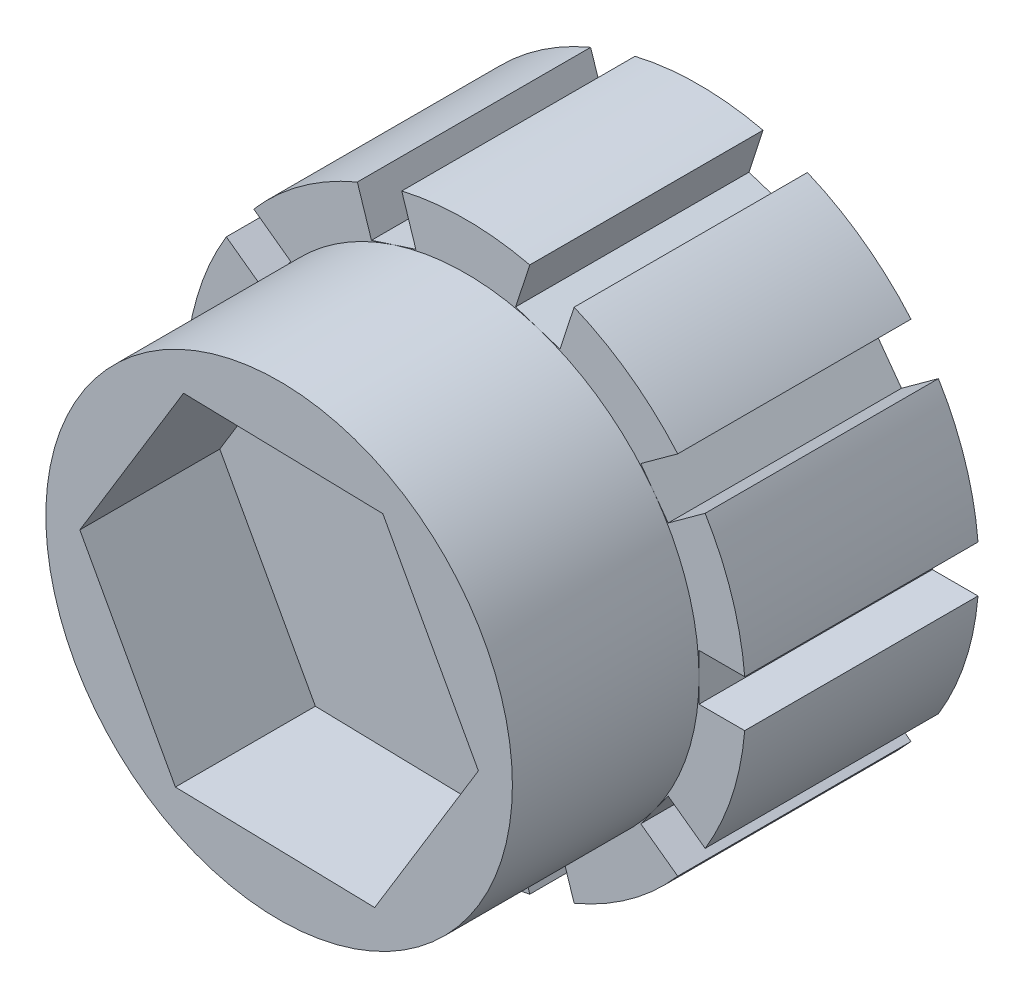
from build123d import *

# Parameters (mm, degrees)
SKETCH1_R           = 6
BOSS_EXTRUDE1_DEPTH = 5
SKETCH2_R           = 5
BOSS_EXTRUDE2_DEPTH = 4
CUT_EXTRUDE1_DEPTH  = 3
SKETCH4_W           = 2
SKETCH4_H           = 1
CUT_EXTRUDE2_DEPTH  = 10


with BuildPart() as part:
    # Sketch1 → Boss-Extrude1 (new body)
    with BuildSketch(Plane.XY):
        Circle(SKETCH1_R)
    extrude(amount=BOSS_EXTRUDE1_DEPTH)

    # Sketch2 → Boss-Extrude2 (add)
    with BuildSketch(Plane.XY.offset(5)):
        Circle(SKETCH2_R)
    extrude(amount=BOSS_EXTRUDE2_DEPTH)

    # Sketch3 → Cut-Extrude1 (cut)
    with BuildSketch(Plane.XY.offset(9)):
        Polygon((2.048231561, -3.749410728), (4.27120072, -0.1008848), (2.222969159, 3.648525928), (-2.048231561, 3.749410728), (-4.27120072, 0.1008848), (-2.222969159, -3.648525928), align=None)
    extrude(amount=-CUT_EXTRUDE1_DEPTH, mode=Mode.SUBTRACT)

    # Sketch4 → Cut-Extrude2 (cut)
    with BuildSketch(Plane(origin=(0, 0, 0), x_dir=(-1, 0, 0), z_dir=(0, 0, -1))):
        Polygon((5.957011587, -3.709988269), (5.369226334, -4.519005263), (3.751192346, -3.343434759), (4.338977598, -2.534417764), align=None)
        with Locations((6, 0)):
            Rectangle(SKETCH4_W, SKETCH4_H)
        Polygon((2.638647219, -6.502887117), (1.687590702, -6.811904111), (1.069556714, -4.909791079), (2.02061323, -4.600774084), align=None)
        Polygon((-1.687590702, -6.811904111), (-2.638647219, -6.502887117), (-2.02061323, -4.600774084), (-1.069556714, -4.909791079), align=None)
        Polygon((-5.369226334, -4.519005263), (-5.957011587, -3.709988269), (-4.338977598, -2.534417764), (-3.751192346, -3.343434759), align=None)
        with Locations((-6, 0)):
            Rectangle(SKETCH4_W, SKETCH4_H)
        Polygon((-5.957011587, 3.709988269), (-5.369226334, 4.519005263), (-3.751192346, 3.343434759), (-4.338977598, 2.534417764), align=None)
        Polygon((-2.638647219, 6.502887117), (-1.687590702, 6.811904111), (-1.069556714, 4.909791079), (-2.02061323, 4.600774084), align=None)
        Polygon((1.687590702, 6.811904111), (2.638647219, 6.502887117), (2.02061323, 4.600774084), (1.069556714, 4.909791079), align=None)
        Polygon((5.369226334, 4.519005263), (5.957011587, 3.709988269), (4.338977598, 2.534417764), (3.751192346, 3.343434759), align=None)
    extrude(amount=-CUT_EXTRUDE2_DEPTH, mode=Mode.SUBTRACT)


solid = part.part
